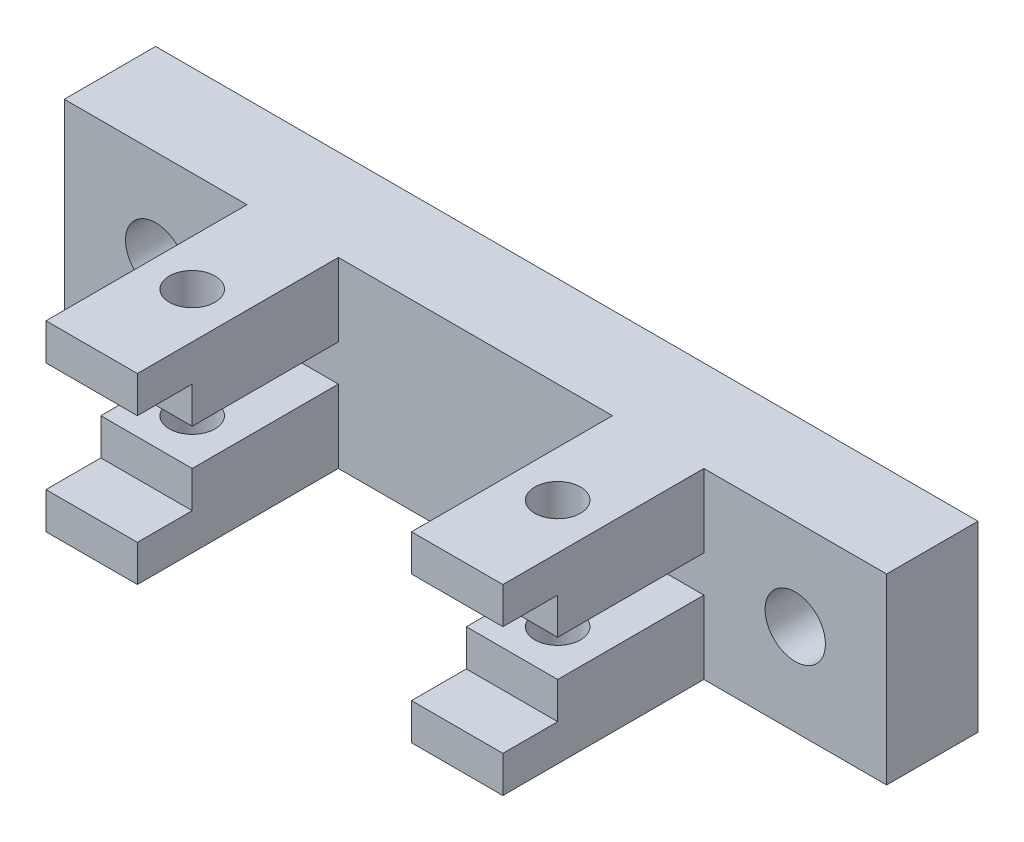
from build123d import *

# Parameters (mm, degrees)
SKETCH_1_W          = 45
SKETCH_1_H          = 10
EXTRUDE_1_DEPTH     = 5
SKETCH_2_W          = 5
SKETCH_2_H          = 4
EXTRUDE_2_DEPTH     = 11
SKETCH_3_W          = 5
SKETCH_3_H          = 2
CUT_EXTRUDE_1_DEPTH = 3
SKETCH_4_W          = 5
SKETCH_4_H          = 2
CUT_EXTRUDE_2_DEPTH = 3
SKETCH_5_R          = 1.25
CUT_EXTRUDE_3_DEPTH = 10
SKETCH_6_R          = 1.65
CUT_EXTRUDE_4_DEPTH = 5
SKETCH_7_W          = 5
SKETCH_7_H          = 4
EXTRUDE_3_DEPTH     = 11
SKETCH_8_W          = 5
SKETCH_8_H          = 2
CUT_EXTRUDE_5_DEPTH = 3
SKETCH_9_W          = 5
SKETCH_9_H          = 2
CUT_EXTRUDE_6_DEPTH = 3
CUT_EXTRUDE_START   = -5
SKETCH_11_R         = 1.25
CUT_EXTRUDE_7_DEPTH = 5


with BuildPart() as part:
    # Эскиз1 → Бобышка-Вытянуть1 (new body)
    with BuildSketch(Plane.XY):
        Rectangle(SKETCH_1_W, SKETCH_1_H)
    extrude(amount=EXTRUDE_1_DEPTH)

    # Эскиз2 → Бобышка-Вытянуть2 (add)
    with BuildSketch(Plane.XY.offset(5)):
        with Locations((-10, 3)):
            Rectangle(SKETCH_2_W, SKETCH_2_H)
        with Locations((10, 3)):
            Rectangle(SKETCH_2_W, SKETCH_2_H)
    extrude(amount=EXTRUDE_2_DEPTH)

    # Эскиз3 → Вырез-Вытянуть1 (cut)
    with BuildSketch(Plane.XY.offset(16)):
        with Locations((-10, 2)):
            Rectangle(SKETCH_3_W, SKETCH_3_H)
    extrude(amount=-CUT_EXTRUDE_1_DEPTH, mode=Mode.SUBTRACT)

    # Эскиз4 → Вырез-Вытянуть2 (cut)
    with BuildSketch(Plane.XY.offset(16)):
        with Locations((10, 2)):
            Rectangle(SKETCH_4_W, SKETCH_4_H)
    extrude(amount=-CUT_EXTRUDE_2_DEPTH, mode=Mode.SUBTRACT)

    # Эскиз5 → Вырез-Вытянуть3 (cut)
    with BuildSketch(Plane(origin=(0, 5, 0), x_dir=(1, 0, 0), z_dir=(0, 1, 0))):
        with Locations(Location((-10, -10.5, 0), (0, 0, 270))):
            Circle(SKETCH_5_R)
        with Locations(Location((10, -10.5, 0), (0, 0, 270))):
            Circle(SKETCH_5_R)
    extrude(amount=-CUT_EXTRUDE_3_DEPTH, mode=Mode.SUBTRACT)

    # Эскиз6 → Вырез-Вытянуть4 (cut)
    with BuildSketch(Plane.XY.offset(5)):
        with Locations((-17.5, 0)):
            Circle(SKETCH_6_R)
        with Locations((17.5, 0)):
            Circle(SKETCH_6_R)
    extrude(amount=-CUT_EXTRUDE_4_DEPTH, mode=Mode.SUBTRACT)

    # Эскиз7 → Бобышка-Вытянуть3 (add)
    with BuildSketch(Plane.XY.offset(5)):
        with Locations((-10, -3)):
            Rectangle(SKETCH_7_W, SKETCH_7_H)
        with Locations((10, -3)):
            Rectangle(SKETCH_7_W, SKETCH_7_H)
    extrude(amount=EXTRUDE_3_DEPTH)

    # Эскиз8 → Вырез-Вытянуть5 (cut)
    with BuildSketch(Plane.XY.offset(16)):
        with Locations((-10, -2)):
            Rectangle(SKETCH_8_W, SKETCH_8_H)
    extrude(amount=-CUT_EXTRUDE_5_DEPTH, mode=Mode.SUBTRACT)

    # Эскиз9 → Вырез-Вытянуть6 (cut)
    with BuildSketch(Plane.XY.offset(16)):
        with Locations((10, -2)):
            Rectangle(SKETCH_9_W, SKETCH_9_H)
    extrude(amount=-CUT_EXTRUDE_6_DEPTH, mode=Mode.SUBTRACT)

    # Эскиз11 → Вырез-Вытянуть7 (cut)
    with BuildSketch(Plane.XZ.offset(5).offset(CUT_EXTRUDE_START)):
        with Locations(Location((-10, 10.5, 0), (0, 0, 90))):
            Circle(SKETCH_11_R)
        with Locations(Location((10, 10.5, 0), (0, 0, 90))):
            Circle(SKETCH_11_R)
    extrude(amount=CUT_EXTRUDE_7_DEPTH, mode=Mode.SUBTRACT)


solid = part.part
